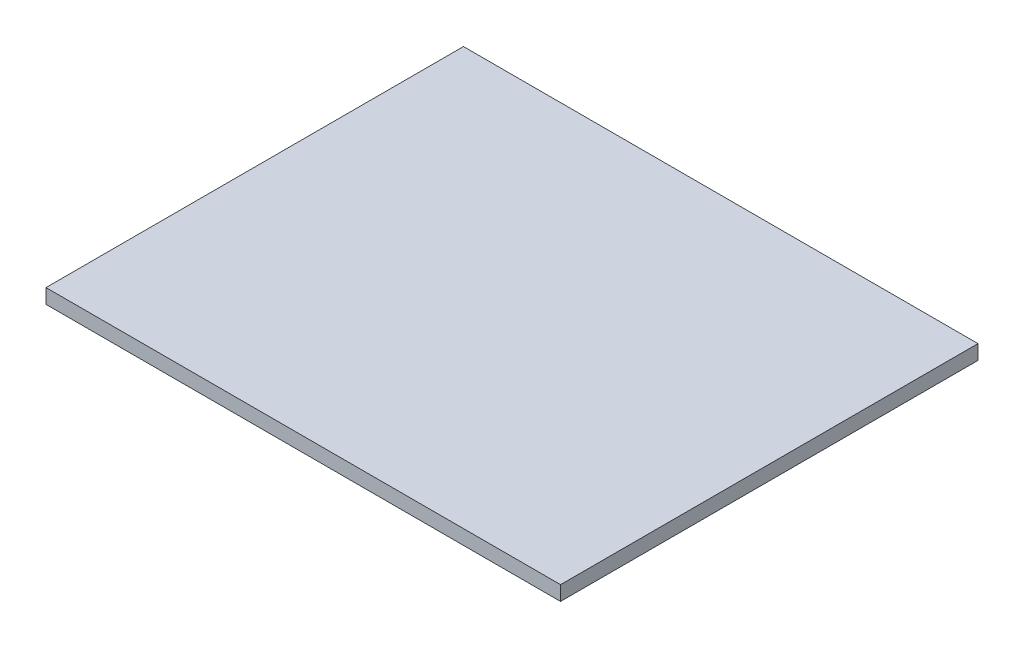
from build123d import *

# Parameters (mm, degrees)
SKETCH1_W           = 53
SKETCH1_H           = 43
BOSS_EXTRUDE1_DEPTH = 1.5


with BuildPart() as part:
    # Sketch1 → Boss-Extrude1 (new body)
    with BuildSketch(Plane(origin=(0, 0, 0), x_dir=(1, 0, 0), z_dir=(0, 1, 0))):
        with Locations((-2.978682171, -9.996124031)):
            Rectangle(SKETCH1_W, SKETCH1_H)
    extrude(amount=BOSS_EXTRUDE1_DEPTH)


solid = part.part
